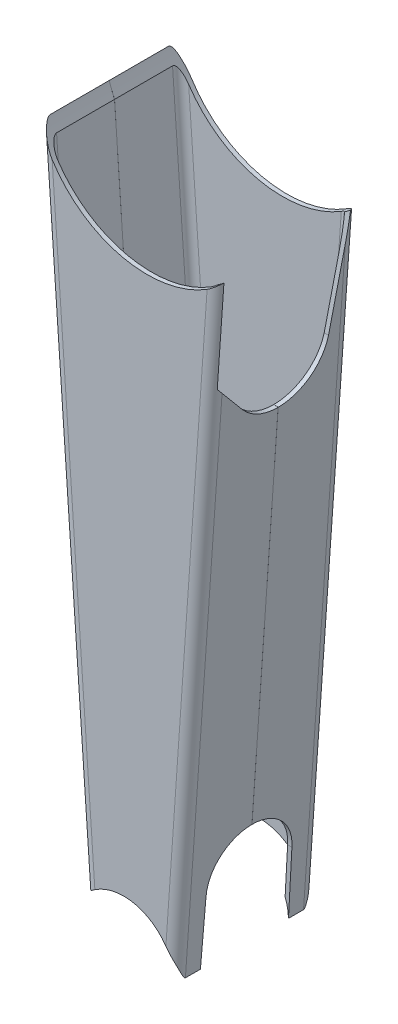
from build123d import *

# Parameters (mm, degrees)
EXTRUDE_1_DEPTH      = 130
CUT_EXTRUDE_2_DEPTH  = 150
SHELL_2_T            = -4
SKETCH_5_R           = 105
CUT_EXTRUDE_3_DEPTH  = 160
CUT_EXTRUDE_12_DEPTH = 19
SKETCH_7_R           = 47.5
CUT_EXTRUDE_16_DEPTH = 714.989159073
FILLET_8_R           = 10
FILLET_9_R           = 10
CUT_EXTRUDE_21_DEPTH = 41
FILLET_10_R          = 7
SKETCH_37_W          = 0.02
SKETCH_37_H          = 620.838123288
CUT_EXTRUDE_22_DEPTH = 703.906153721


with BuildPart() as part:
    # 草图1 → 拉伸1 (new body)
    with BuildSketch(Plane.XY):
        Polygon((0, 0), (0, -634.124605937), (170, -695.999545762), (170, -98.149545762), align=None)
    extrude(amount=EXTRUDE_1_DEPTH)

    # 草图4 → 切除-拉伸2 (cut)
    with BuildSketch(Plane.XY.offset(130)):
        Polygon((0, 0), (45.500354239, -650.685380528), (0, -634.124605937), align=None)
        Polygon((170, -98.149545762), (129.23185683, -681.161155142), (170, -695.999545762), align=None)
    extrude(amount=-CUT_EXTRUDE_2_DEPTH, mode=Mode.SUBTRACT)

    # 抽壳2
    shell_2_openings = [part.faces().sort_by_distance(p)[0] for p in [
        (87.366105534, -665.923267835, 65),
        (85, -49.074772881, 65),
    ]]
    offset(amount=SHELL_2_T, openings=shell_2_openings, kind=Kind.INTERSECTION)

    # 草图5 → 切除-拉伸3 (cut)
    with BuildSketch(Plane.XY.offset(130)):
        with Locations((103.652524405, -16.767652923)):
            Circle(SKETCH_5_R)
    extrude(amount=-CUT_EXTRUDE_3_DEPTH, mode=Mode.SUBTRACT)

    # 草图23 → 切除-拉伸12 (cut)
    with BuildSketch(Plane(origin=(176.002674164, -12.307305898, 0), x_dir=(0, 0, -1), z_dir=(0.9975640502598249, -0.06975647374411818, 0))):
        with BuildLine():
            Line((-124, -86.051857865), (-124, -176.051857865))
            Line((-124, -176.051857865), (-99.322033898, -205.155087739))
            ThreePointArc((-99.322033898, -205.155087739), (-53.240849438, -219.488275513), (-20.683651114, -183.86602586))
            Line((-20.683651114, -183.86602586), (-6, -86.051857865))
            Line((-6, -86.051857865), (-124, -86.051857865))
        make_face()
    extrude(amount=-CUT_EXTRUDE_12_DEPTH, mode=Mode.SUBTRACT)

    # 草图7 → 切除-拉伸16 (cut, through all)
    with BuildSketch(Plane.XY.offset(130)):
        with Locations((81.732465234, -681.401567349)):
            Circle(SKETCH_7_R)
    extrude(amount=-CUT_EXTRUDE_16_DEPTH, mode=Mode.SUBTRACT)

    # 圆角8
    fillet_8_edges = [part.edges().sort_by_distance(p)[0] for p in [
        (24.421349867, -349.241573986, 0),
        (149.615928415, -389.655350452, 0),
    ]]
    fillet(fillet_8_edges, radius=FILLET_8_R)

    # 圆角9
    fillet_9_edges = [part.edges().sort_by_distance(p)[0] for p in [
        (24.421349867, -349.241573986, 130),
        (149.615928415, -389.655350452, 130),
    ]]
    fillet(fillet_9_edges, radius=FILLET_9_R)

    # 草图36 → 切除-拉伸21 (cut)
    with BuildSketch(Plane(origin=(176.002674164, -12.307305898, 0), x_dir=(0, 0, -1), z_dir=(0.9975640502598248, -0.06975647374411817, 0))):
        with BuildLine():
            Line((-105, -610.487122175), (-106, -670.487122175))
            Line((-106, -670.487122175), (-24, -670.487122175))
            Line((-24, -670.487122175), (-25, -610.487122175))
            ThreePointArc((-25, -610.487122175), (-65, -570.487122175), (-105, -610.487122175))
        make_face()
    extrude(amount=-CUT_EXTRUDE_21_DEPTH, mode=Mode.SUBTRACT)

    # 圆角10
    fillet_10_edges = [part.edges().sort_by_distance(p)[0] for p in [
        (146.053243557, -383.261769485, 4),
        (28.742143608, -353.68945513, 4),
        (146.053243557, -383.261769485, 126),
        (28.742143608, -353.68945513, 126),
    ]]
    fillet(fillet_10_edges, radius=FILLET_10_R)

    # 草图37 → 切除-拉伸22 (cut, through all)
    with BuildSketch(Plane(origin=(176.002674164, -12.307305898, 0), x_dir=(0, 0, -1), z_dir=(0.9975640502598248, -0.06975647374411821, 0))):
        with Locations((-65, -357.867245893)):
            Rectangle(SKETCH_37_W, SKETCH_37_H)
    extrude(amount=-CUT_EXTRUDE_22_DEPTH, mode=Mode.SUBTRACT)


with BuildPart() as cut_extrude_22_piece_1:
    # of the separate pieces the step leaves, piece 1, a body of its own (cut_extrude_22_pieces)
    add(part.part.solids().sort_by_distance((126.345578519, -665.094509888, 11))[0])


with BuildPart() as cut_extrude_22_piece_2:
    # of the separate pieces the step leaves, piece 2, a body of its own (cut_extrude_22_pieces)
    add(part.part.solids().sort_by_distance((49.235473677, -646.75772894, 65.01))[0])


solid = Compound([cut_extrude_22_piece_1.part, cut_extrude_22_piece_2.part])
